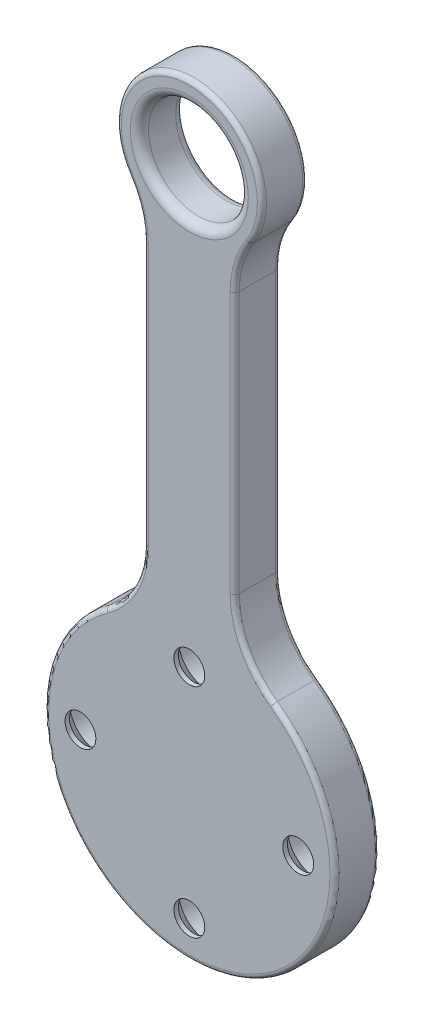
from build123d import *

# Parameters (mm, degrees)
BOSS_EXTRUDE1_DEPTH                              = 5
SKETCH8_R                                        = 16
BOSS_EXTRUDE2_DEPTH                              = 5
CBORE_FOR_M3_HEX_HEAD_MACHINE_SCREW0_D           = 3.4
CBORE_FOR_M3_HEX_HEAD_MACHINE_SCREW0_CBORE_D     = 6.5
CBORE_FOR_M3_HEX_HEAD_MACHINE_SCREW0_CBORE_DEPTH = 3
FILLET1_R                                        = 10
SKETCH7_R                                        = 5.5
CUT_EXTRUDE1_DEPTH                               = 71.03570518
FILLET2_R                                        = 1
FILLET3_R                                        = 0.5
CHAMFER1_SIZE                                    = 1.5


with BuildPart() as part:
    # Sketch1 → Boss-Extrude1 (new body)
    with BuildSketch(Plane.XY.offset(5)):
        with BuildLine():
            Line((-5, 53.755002002), (-5, 13.076696831))
            ThreePointArc((-5, 13.076696831), (0, -14), (5, 13.076696831))
            Line((5, 13.076696831), (5, 53.755002002))
            ThreePointArc((5, 53.755002002), (0, 68), (-5, 53.755002002))
        make_face()
    extrude(amount=-BOSS_EXTRUDE1_DEPTH)

    # Sketch2 → Cut-Revolve1 (revolve, cut)
    with BuildSketch(Plane.XZ.offset(-60), mode=Mode.PRIVATE) as cut_revolve1_sk:
        Polygon((3.5, 5), (0, 5), (0, 0), (4.3, 0), (2.5, 1.8), (2.5, 2), (3.5, 2), align=None)
    revolve(cut_revolve1_sk.sketch.rotate(Axis((0, 60, 5), (0, 0, -1)), 180), axis=Axis((0, 60, 5), (0, 0, -1)), mode=Mode.SUBTRACT)

    # Sketch8 → Boss-Extrude2 (add)
    with BuildSketch(Plane(origin=(0, 0, 0), x_dir=(-1, 0, 0), z_dir=(0, 0, -1))):
        Circle(SKETCH8_R)
    extrude(amount=-BOSS_EXTRUDE2_DEPTH)

    # CBORE for M3 Hex Head Machine Screw0 (through all)
    with Locations(Plane(origin=(0, 0, 0), x_dir=(-1, 0, 0), z_dir=(0, 0, -1))):
        with Locations((0, 12), (12, 0), (-12, 0), (0, -12)):
            CounterBoreHole(CBORE_FOR_M3_HEX_HEAD_MACHINE_SCREW0_D / 2, CBORE_FOR_M3_HEX_HEAD_MACHINE_SCREW0_CBORE_D / 2, CBORE_FOR_M3_HEX_HEAD_MACHINE_SCREW0_CBORE_DEPTH)

    # Fillet1
    fillet1_edges = [part.edges().sort_by_distance(p)[0] for p in [
        (5, 15.198684154, 2.5),
        (-5, 15.198684154, 2.5),
        (5, 53.755002002, 2.5),
        (-5, 53.755002002, 2.5),
    ]]
    fillet(fillet1_edges, radius=FILLET1_R)

    # Sketch7 → Cut-Extrude1 (cut, through all)
    with BuildSketch(Plane(origin=(0, 0, 0), x_dir=(-1, 0, 0), z_dir=(0, 0, -1))):
        with Locations((0, 60)):
            Circle(SKETCH7_R)
    extrude(amount=-CUT_EXTRUDE1_DEPTH, mode=Mode.SUBTRACT)

    # Fillet2
    fillet2_edges = [part.edges().sort_by_distance(p)[0] for p in [
        (5.5, 60, 0),
        (5.5, 60, 5),
    ]]
    fillet(fillet2_edges, radius=FILLET2_R)

    # Fillet3
    fillet3_edges = [part.edges().sort_by_distance(p)[0] for p in [
        (0, -16, 0),
        (0, -16, 5),
        (5, 35.643443105, 0),
        (5, 35.643443105, 5),
        (-5, 35.643443105, 5),
        (-5, 35.643443105, 0),
        (0, 68, 5),
        (0, 68, 0),
        (6.120464323, 16.637429527, 5),
        (6.120464323, 16.637429527, 0),
        (-6.120464323, 16.637429527, 0),
        (-6.120464323, 16.637429527, 5),
        (-5.425728922, 52.936876975, 5),
        (-5.425728922, 52.936876975, 0),
        (5.425728922, 52.936876975, 5),
        (5.425728922, 52.936876975, 0),
    ]]
    fillet(fillet3_edges, radius=FILLET3_R)

    # Chamfer1
    chamfer1_edges = [part.edges().sort_by_distance(p)[0] for p in [
        (-1.7, -12, 3),
        (10.3, 0, 3),
        (-13.7, 0, 3),
        (-1.7, 12, 3),
    ]]
    chamfer(chamfer1_edges, length=CHAMFER1_SIZE)


solid = part.part
